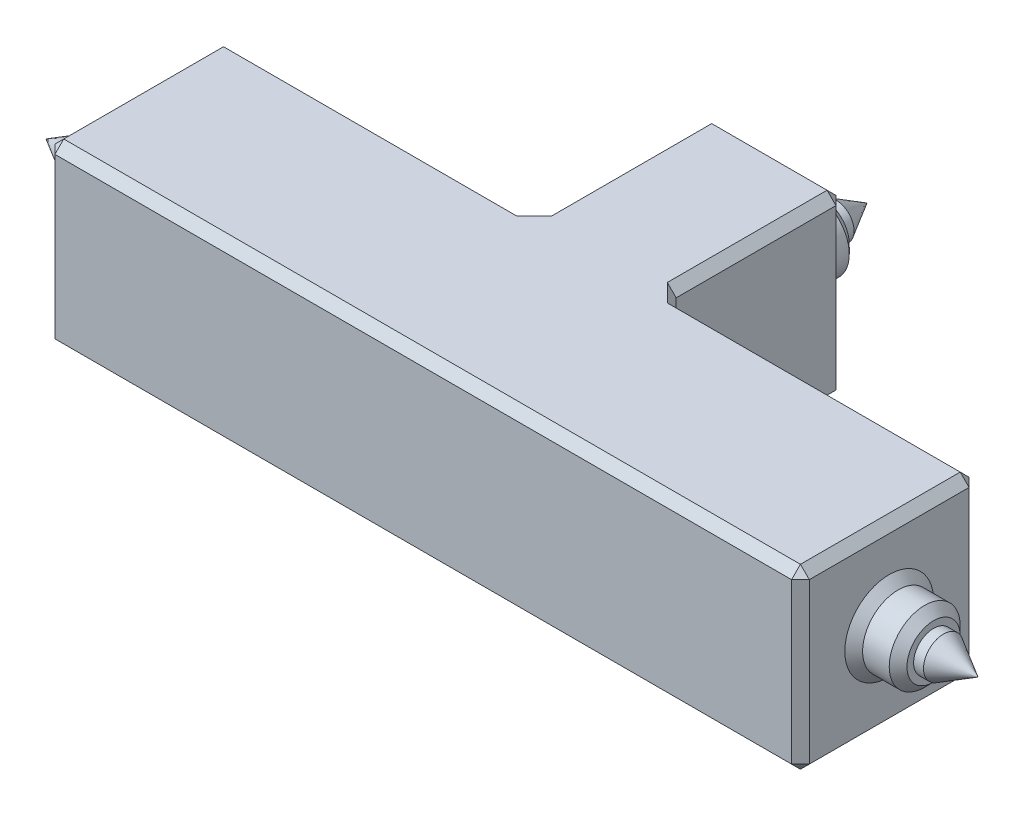
from build123d import *

# Parameters (mm, degrees)
BOSS_EXTRUDE1_DEPTH = 20
SKETCH2_R           = 4
SKETCH2_R_2         = 2
BOSS_EXTRUDE2_DEPTH = 5
SKETCH2_4_R         = 2
BOSS_EXTRUDE3_DEPTH = 10
SKETCH3_R           = 4
SKETCH3_R_2         = 1.75
BOSS_EXTRUDE4_DEPTH = 5
SKETCH3_2_R         = 1.75
BOSS_EXTRUDE5_DEPTH = 10
BOSS_EXTRUDE6_START = 5
SKETCH4_R           = 4
SKETCH4_R_2         = 2.25
BOSS_EXTRUDE6_DEPTH = 5
BOSS_EXTRUDE7_START = 10
SKETCH4_2_R         = 2.25
BOSS_EXTRUDE7_DEPTH = 10
CHAMFER1_SIZE       = 3.03
CHAMFER1_SIZE2      = 1.749371316
CHAMFER2_SIZE       = 3.46
CHAMFER2_SIZE2      = 1.997631931
CHAMFER3_SIZE       = 3.89
CHAMFER3_SIZE2      = 2.245892547
CHAMFER4_SIZE       = 1


with BuildPart() as part:
    # Sketch1 → Boss-Extrude1 (new body)
    with BuildSketch(Plane(origin=(0, 0, 0), x_dir=(1, 0, 0), z_dir=(0, 1, 0))):
        Polygon((-42.5, 0), (-42.5, -20), (42.5, -20), (42.5, 0), (7.5, 0), (7.5, 20), (-7.5, 20), (-7.5, 0), align=None)
    extrude(amount=BOSS_EXTRUDE1_DEPTH)

    # Sketch2 → Boss-Extrude2 (add)
    with BuildSketch(Plane(origin=(0, 0, -20), x_dir=(-1, 0, 0), z_dir=(0, 0, -1))):
        with Locations((0, 10)):
            Circle(SKETCH2_R)
        with Locations((0, 10)):
            Circle(SKETCH2_R_2, mode=Mode.SUBTRACT)
    extrude(amount=BOSS_EXTRUDE2_DEPTH)

    # Sketch2<4> → Boss-Extrude3 (add)
    with BuildSketch(Plane(origin=(0, 0, -20), x_dir=(-1, 0, 0), z_dir=(0, 0, -1))):
        with Locations((0, 10)):
            Circle(SKETCH2_4_R)
    extrude(amount=BOSS_EXTRUDE3_DEPTH)

    # Sketch3 → Boss-Extrude4 (add)
    with BuildSketch(Plane.ZY.offset(42.5)):
        with Locations((10, 10)):
            Circle(SKETCH3_R)
        with Locations((10, 10)):
            Circle(SKETCH3_R_2, mode=Mode.SUBTRACT)
    extrude(amount=BOSS_EXTRUDE4_DEPTH)

    # Sketch3<2> → Boss-Extrude5 (add)
    with BuildSketch(Plane.ZY.offset(42.5)):
        with Locations((10, 10)):
            Circle(SKETCH3_2_R)
    extrude(amount=BOSS_EXTRUDE5_DEPTH)

    # Sketch4 → Boss-Extrude6 (add)
    with BuildSketch(Plane(origin=(42.5, 0, 0), x_dir=(0, 0, -1), z_dir=(1, 0, 0)).offset(BOSS_EXTRUDE6_START)):
        with Locations((-10, 10)):
            Circle(SKETCH4_R)
        with Locations((-10, 10)):
            Circle(SKETCH4_R_2, mode=Mode.SUBTRACT)
    extrude(amount=-BOSS_EXTRUDE6_DEPTH)

    # Sketch4<2> → Boss-Extrude7 (add)
    with BuildSketch(Plane(origin=(42.5, 0, 0), x_dir=(0, 0, -1), z_dir=(1, 0, 0)).offset(BOSS_EXTRUDE7_START)):
        with Locations((-10, 10)):
            Circle(SKETCH4_2_R)
    extrude(amount=-BOSS_EXTRUDE7_DEPTH)

    # Chamfer1
    chamfer1_edges = [part.edges().sort_by_distance(p)[0] for p in [
        (-52.5, 10, 8.25),
    ]]
    chamfer1_side = [part.faces().sort_by_distance(p)[0] for p in [
        (-50, 10, 8.25),
    ]]
    chamfer(chamfer1_edges, length=CHAMFER1_SIZE, length2=CHAMFER1_SIZE2, reference=chamfer1_side[0])

    # Chamfer2
    chamfer2_edges = [part.edges().sort_by_distance(p)[0] for p in [
        (2, 10, -30),
    ]]
    chamfer2_side = [part.faces().sort_by_distance(p)[0] for p in [
        (2, 10, -27.5),
    ]]
    chamfer(chamfer2_edges, length=CHAMFER2_SIZE, length2=CHAMFER2_SIZE2, reference=chamfer2_side[0])

    # Chamfer3
    chamfer3_edges = [part.edges().sort_by_distance(p)[0] for p in [
        (52.5, 10, 12.25),
    ]]
    chamfer3_side = [part.faces().sort_by_distance(p)[0] for p in [
        (50, 10, 12.25),
    ]]
    chamfer(chamfer3_edges, length=CHAMFER3_SIZE, length2=CHAMFER3_SIZE2, reference=chamfer3_side[0])

    # Chamfer4
    chamfer4_edges = [part.edges().sort_by_distance(p)[0] for p in [
        (42.5, 10, 14),
        (47.5, 10, 14),
        (4, 10, -20),
        (4, 10, -25),
        (-42.5, 10, 6),
        (-47.5, 10, 6),
        (-42.5, 10, 20),
        (42.5, 10, 20),
        (7.5, 10, -20),
        (42.5, 10, 0),
        (7.5, 10, 0),
        (42.5, 0, 10),
        (25, 0, 0),
        (7.5, 0, -10),
        (0, 0, -20),
        (0, 0, 20),
        (-42.5, 0, 10),
        (-7.5, 10, -20),
        (-7.5, 0, -10),
        (-7.5, 10, 0),
        (-25, 0, 0),
        (-42.5, 10, 0),
        (-42.5, 20, 10),
        (-25, 20, 0),
        (-7.5, 20, -10),
        (0, 20, -20),
        (7.5, 20, -10),
        (25, 20, 0),
        (42.5, 20, 10),
        (0, 20, 20),
    ]]
    chamfer(chamfer4_edges, length=CHAMFER4_SIZE)


solid = part.part
